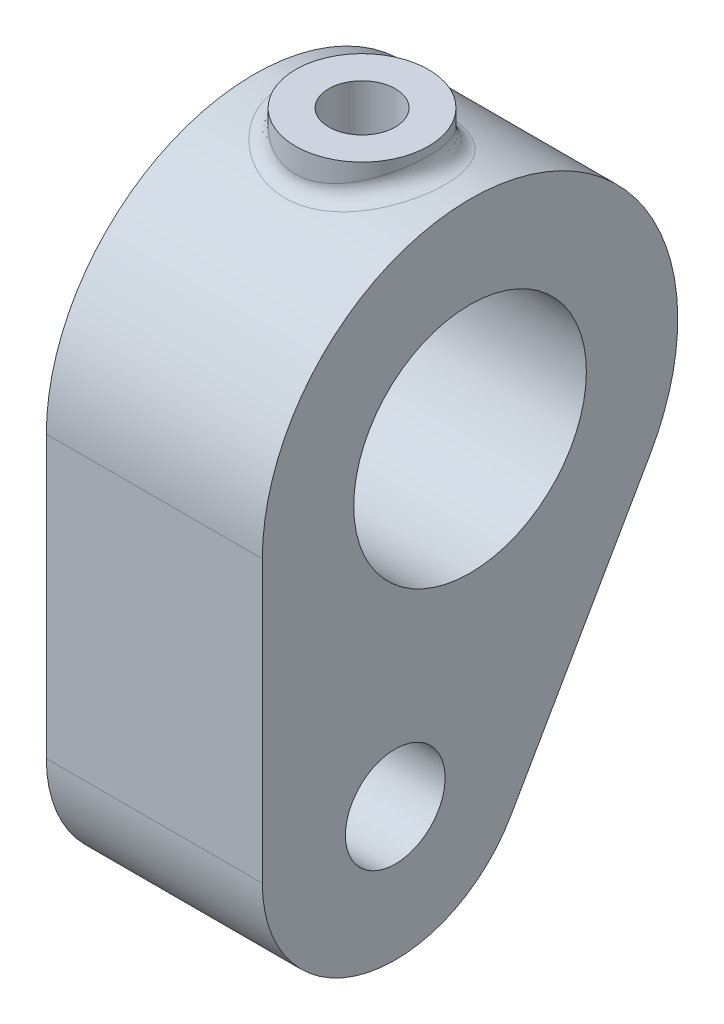
from build123d import *

# Parameters (mm, degrees)
SKETCH_1_R               = 14
SKETCH_1_R_2             = 6
EXTRUDE_1_DEPTH          = 13
EXTRUDE_2_REACH          = 84.767
EXTRUDE_2_END_RADIUS     = 25
SKETCH_2_R               = 8
CUT_EXTRUDE_3_REACH      = 84.767
CUT_EXTRUDE_3_END_RADIUS = 14
SKETCH_3_R               = 4
FILLET_1_R               = 2


with BuildPart() as part:
    # 草圖1 → 伸長1 (new, symmetric)
    with BuildSketch(Plane(origin=(0, 0, 0), x_dir=(0, 0, -1), z_dir=(1, 0, 0))):
        with BuildLine():
            Line((-25, -33.823069051), (-25, 0))
            ThreePointArc((-25, 0), (6.428571429, 24.159335036), (21.693877551, -12.424800876))
            Line((21.693877551, -12.424800876), (4.884081633, -41.774941611))
            ThreePointArc((4.884081633, -41.774941611), (-13.114285714, -49.285043474), (-25, -33.823069051))
        make_face()
        with Locations(Location((0, 0, 0), (0, 0, 180))):
            Circle(SKETCH_1_R, mode=Mode.SUBTRACT)
        with Locations(Location((-9, -33.823069051, 0), (0, 0, 180))):
            Circle(SKETCH_1_R_2, mode=Mode.SUBTRACT)
    extrude(amount=EXTRUDE_1_DEPTH, both=True)

    # 伸長2: up to this cylinder (the profile starts outside it)
    extrude_2_end = Plane(origin=(0, 0, 0), z_dir=(-1, 0, 0)) * Cylinder(EXTRUDE_2_END_RADIUS, 220.534, mode=Mode.PRIVATE)
    # 草圖2 → 伸長2 (add, up to the surface)
    with BuildSketch(Plane(origin=(0, 28, 0), x_dir=(-1, 0, 0), z_dir=(0, 1, 0)), mode=Mode.PRIVATE) as extrude_2_sk1:
        with Locations(Location((0, 0, 0), (0, 0, 90))):
            Circle(SKETCH_2_R)
    extrude_2_tool1 = extrude(extrude_2_sk1.sketch, amount=-EXTRUDE_2_REACH, mode=Mode.PRIVATE) - extrude_2_end
    add(extrude_2_tool1.solids().sort_by_distance((0, 28, 0))[0])

    # 伸長3: up to this cylinder (the profile starts outside it)
    cut_extrude_3_end = Plane(origin=(0, 0, 0), z_dir=(-1, 0, 0)) * Cylinder(CUT_EXTRUDE_3_END_RADIUS, 198.534, mode=Mode.PRIVATE)
    # 草圖3 → 伸長3 (cut, up to the surface)
    with BuildSketch(Plane(origin=(0, 28, 0), x_dir=(1, 0, 0), z_dir=(0, 1, 0)), mode=Mode.PRIVATE) as cut_extrude_3_sk1:
        with Locations(Location((0, 0, 0), (0, 0, 270))):
            Circle(SKETCH_3_R)
    cut_extrude_3_tool1 = extrude(cut_extrude_3_sk1.sketch, amount=-CUT_EXTRUDE_3_REACH, mode=Mode.PRIVATE) - cut_extrude_3_end
    add(cut_extrude_3_tool1.solids().sort_by_distance((0, 28, 0))[0], mode=Mode.SUBTRACT)

    # 圓角1
    fillet_1_edges = [part.edges().sort_by_distance(p)[0] for p in [
        (0, 23.685438565, -8),
    ]]
    fillet(fillet_1_edges, radius=FILLET_1_R)


solid = part.part
